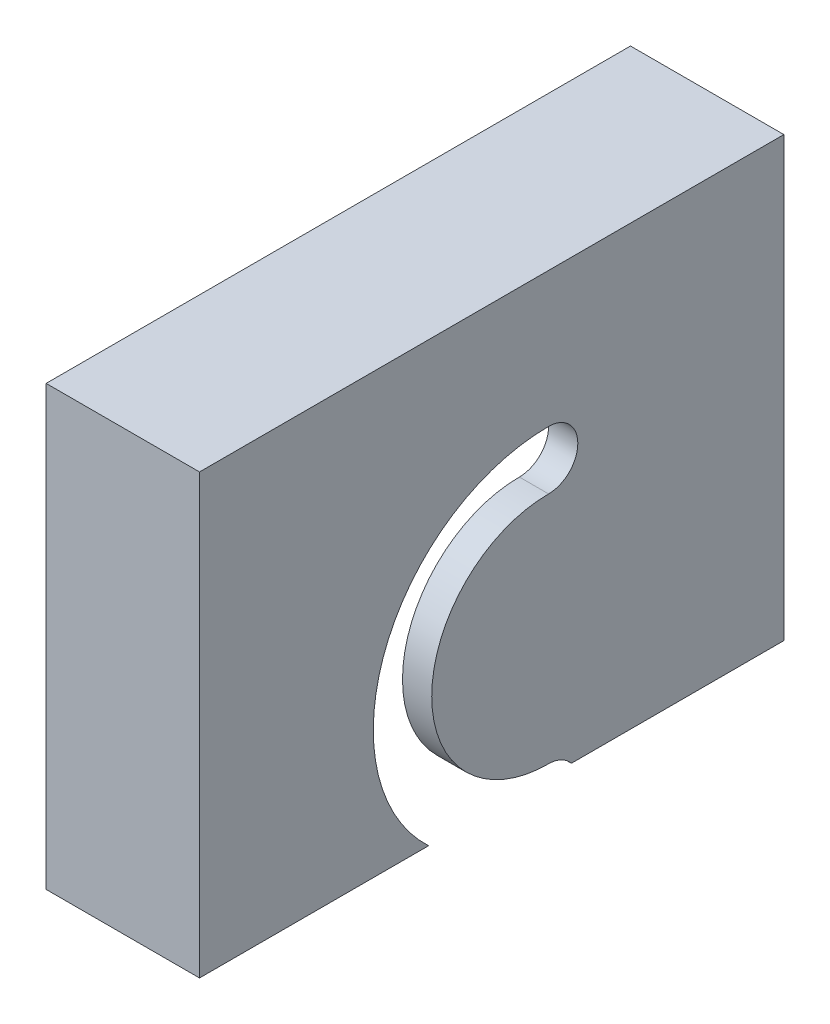
from build123d import *

# Parameters (mm, degrees)
SKETCH1_W           = 80
SKETCH1_H           = 60
BOSS_EXTRUDE1_DEPTH = 21
CUT_EXTRUDE1_DEPTH  = 21
SKETCH3_W           = 70
SKETCH3_H           = 55
CUT_EXTRUDE2_DEPTH  = 17


with BuildPart() as part:
    # Sketch1 → Boss-Extrude1 (new body)
    with BuildSketch(Plane(origin=(0, 0, 0), x_dir=(0, 0, -1), z_dir=(1, 0, 0))):
        Rectangle(SKETCH1_W, SKETCH1_H)
    extrude(amount=BOSS_EXTRUDE1_DEPTH)

    # Sketch2 → Cut-Extrude1 (cut)
    with BuildSketch(Plane(origin=(21, 0, 0), x_dir=(0, 0, -1), z_dir=(1, 0, 0))):
        with BuildLine():
            ThreePointArc((7.79, 11.5), (-16.21, -12.5), (7.79, -36.5))
            ThreePointArc((7.79, -36.5), (11.79, -32.5), (7.79, -28.5))
            ThreePointArc((7.79, -28.5), (-8.21, -12.5), (7.79, 3.5))
            ThreePointArc((7.79, 3.5), (11.79, 7.5), (7.79, 11.5))
        make_face()
    extrude(amount=-CUT_EXTRUDE1_DEPTH, mode=Mode.SUBTRACT)

    # Sketch3 → Cut-Extrude2 (cut)
    with BuildSketch(Plane.ZY):
        with Locations((0, -2.5)):
            Rectangle(SKETCH3_W, SKETCH3_H)
    extrude(amount=-CUT_EXTRUDE2_DEPTH, mode=Mode.SUBTRACT)


solid = part.part
